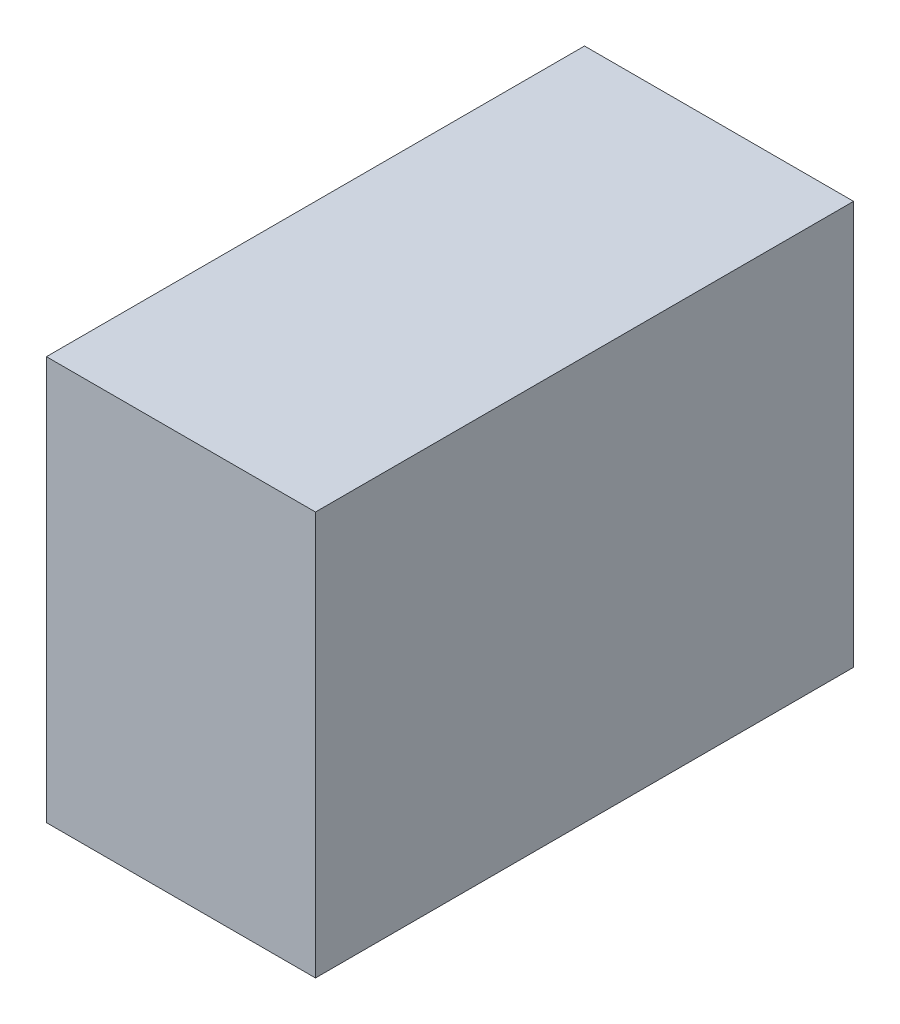
from build123d import *

# Parameters (mm, degrees)
SKETCH1_R           = 2.5
BOSS_EXTRUDE1_DEPTH = 5
SKETCH2_W           = 30
SKETCH2_H           = 60
BOSS_EXTRUDE2_DEPTH = 45


with BuildPart() as part:
    # Sketch1 → Boss-Extrude1 (new body)
    with BuildSketch(Plane(origin=(0, 0, 0), x_dir=(1, 0, 0), z_dir=(0, 1, 0))):
        Circle(SKETCH1_R)
    extrude(amount=BOSS_EXTRUDE1_DEPTH)

    # Sketch2 → Boss-Extrude2 (add)
    with BuildSketch(Plane(origin=(0, 5, 0), x_dir=(1, 0, 0), z_dir=(0, 1, 0))):
        with Locations((0, -15)):
            Rectangle(SKETCH2_W, SKETCH2_H)
    extrude(amount=BOSS_EXTRUDE2_DEPTH)


solid = part.part
